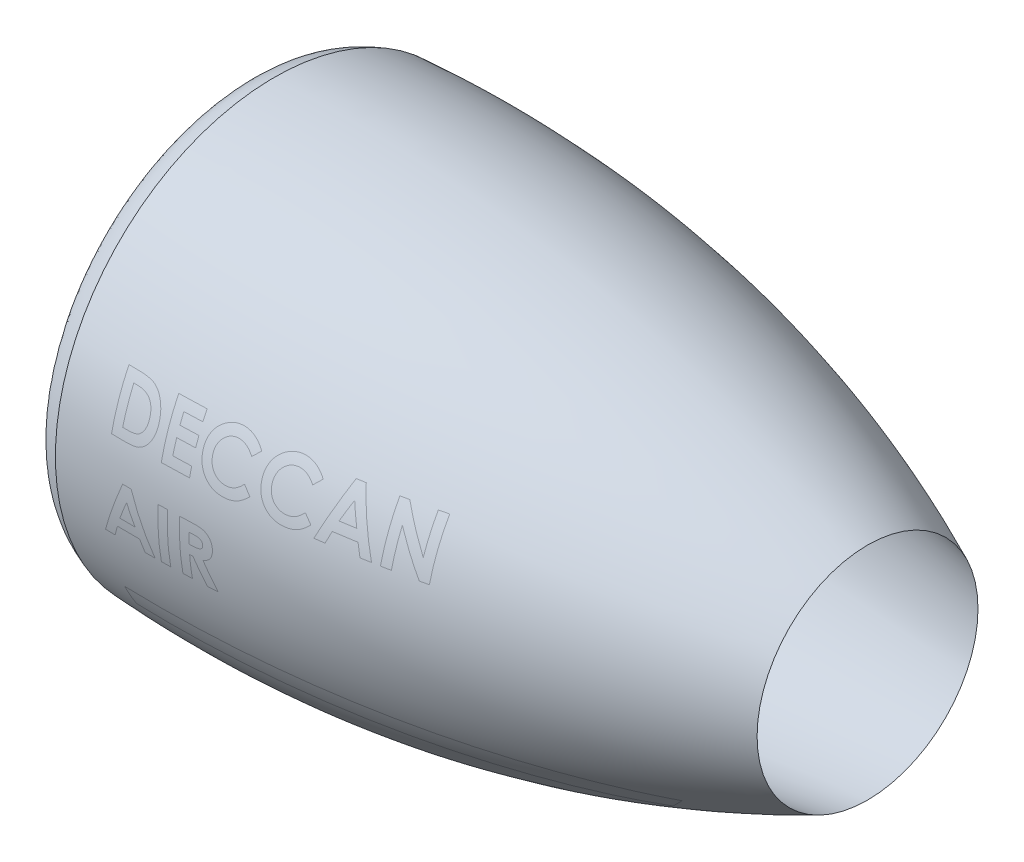
from build123d import *


with BuildPart() as part:
    # Sketch2 → Revolve1 (revolve)
    with BuildSketch(Plane.XY, mode=Mode.PRIVATE) as revolve1_sk:
        with BuildLine():
            Line((0, 180), (25, 180))
            Line((25, 180), (46.085592802, 190))
            Line((46.085592802, 190), (71.085592802, 190))
            Line((71.085592802, 190), (580, 108))
            add(Edge.make_bspline(
                [(0, 214.096159007), (307.113220799, 232.704676897), (580, 108)],
                knots=[0, 0, 0, 1, 1, 1], degree=2))
            add(Edge.make_bspline(
                [(0, 214.096159007), (-44.152280258, 199.186521683), (0, 180)],
                knots=[0, 0, 0, 1, 1, 1], degree=2))
        make_face()
    revolve(revolve1_sk.sketch.rotate(Axis((660.393267449, 0, 0), (-1, 0, 0)), 90), axis=Axis((660.393267449, 0, 0), (-1, 0, 0)))


solid = part.part
